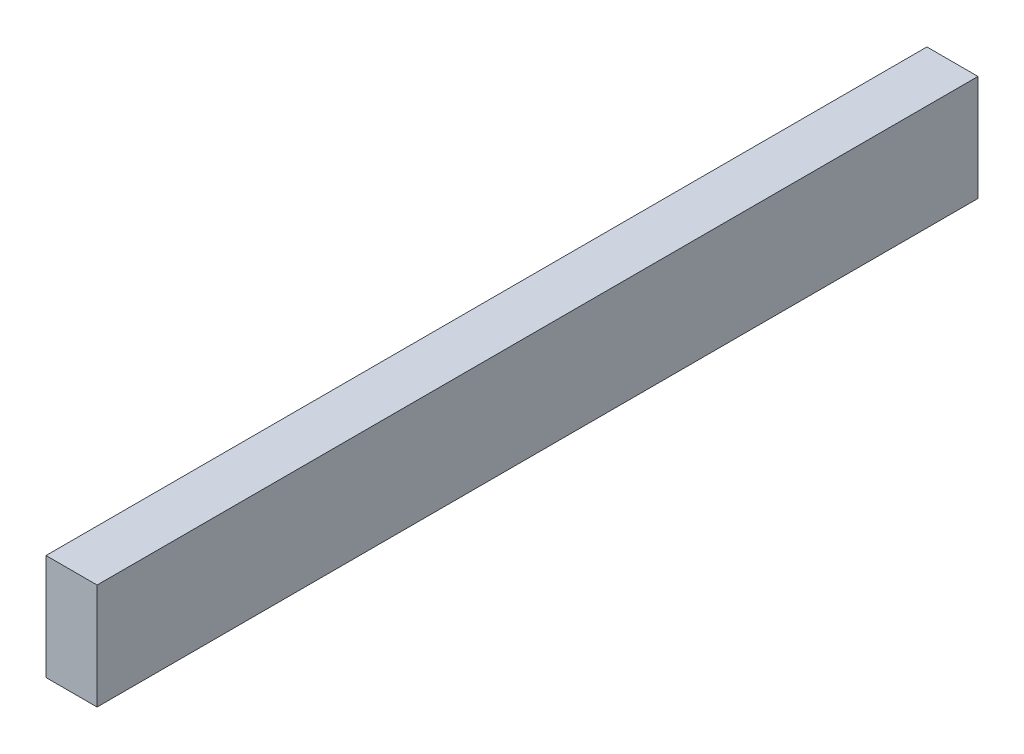
from build123d import *

# Parameters (mm, degrees)
SKETCH1_W           = 29
SKETCH1_H           = 60
BOSS_EXTRUDE1_DEPTH = 500


with BuildPart() as part:
    # Sketch1 → Boss-Extrude1 (new body)
    with BuildSketch(Plane.XY):
        with Locations((14.5, 30)):
            Rectangle(SKETCH1_W, SKETCH1_H)
    extrude(amount=BOSS_EXTRUDE1_DEPTH)


solid = part.part
